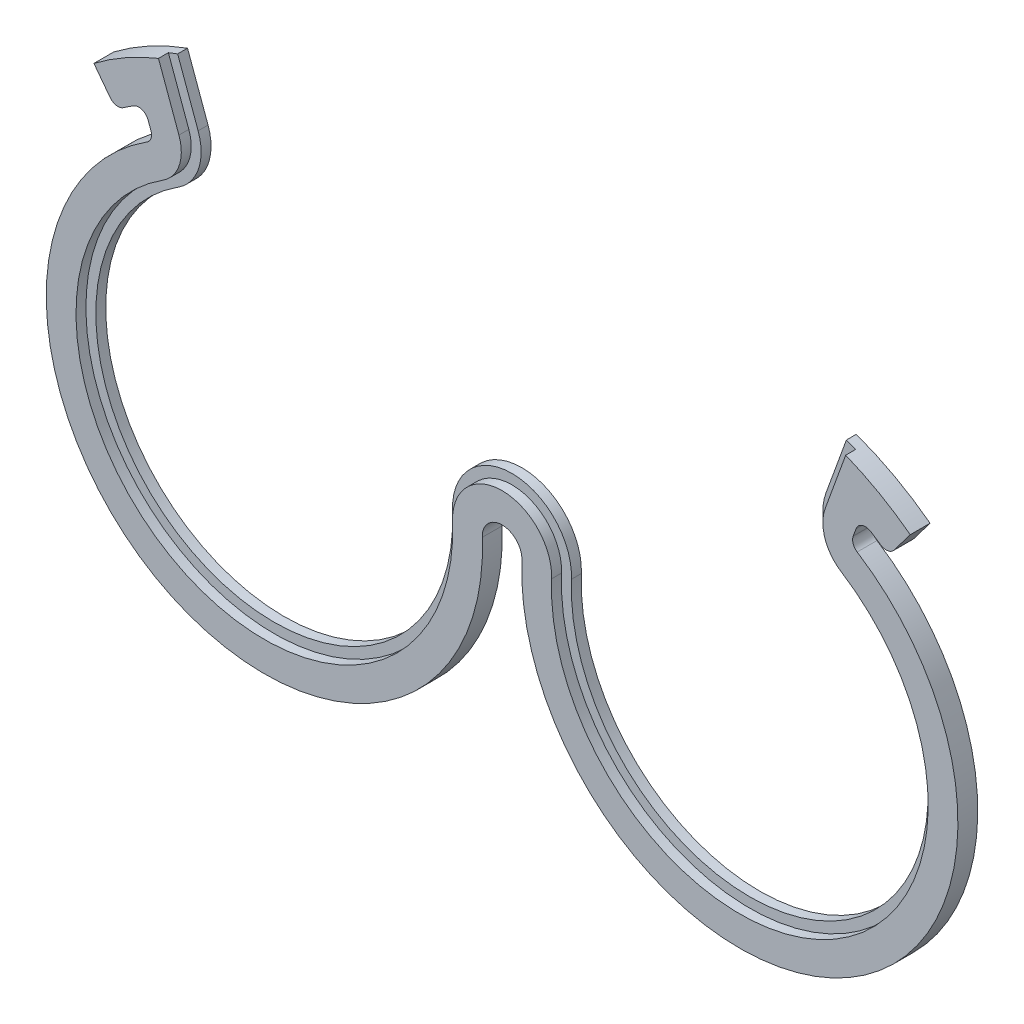
from build123d import *
from build123d.topology import SkipClean

# Parameters (mm, degrees)
BASE_EXTRUSION_DEPTH    = 2
ENL_V_START             = -1
ENL_V_MAT_EXTRU_1_DEPTH = 1


with BuildPart() as part:
    # Esquisse1 → Base-Extrusion (new body)
    with BuildSketch(Plane.XY):
        with BuildLine():
            Line((33.747574085, 26.781239692), (31.678333174, 21.096047015))
            ThreePointArc((31.678333174, 21.096047015), (31.641362763, 17.781057074), (33.686188392, 15.171610147))
            ThreePointArc((33.686188392, 15.171610147), (32.319294254, -15.962122137), (6.015631788, 0.75))
            ThreePointArc((6.015631788, 0.75), (4.350969402, 5.153311931), (0.020842383, 7))
            Line((0.020842383, 7), (0.020842383, 3))
            ThreePointArc((0.020842383, 3), (1.464218056, 2.38443731), (2.019105518, 0.916666667))
            ThreePointArc((2.019105518, 0.916666667), (34.168026311, -19.509260389), (35.838674701, 18.543079068))
            ThreePointArc((35.838674701, 18.543079068), (35.429709575, 19.064968454), (35.437103657, 19.727966442))
            Line((35.437103657, 19.727966442), (35.72395853, 20.516093727))
            ThreePointArc((35.72395853, 20.516093727), (36.339050842, 21.119924861), (37.195305146, 21.021035229))
            ThreePointArc((37.195305146, 21.021035229), (37.69827952, 20.696790529), (38.19329026, 20.360513539))
            ThreePointArc((38.19329026, 20.360513539), (38.921758709, 20.193200611), (39.562738511, 20.577654497))
            Line((39.562738511, 20.577654497), (41.19141405, 22.731152258))
            ThreePointArc((41.19141405, 22.731152258), (37.620869006, 25.034414863), (33.747574085, 26.781239692))
        make_face()
    extrude(amount=BASE_EXTRUSION_DEPTH)

    # Esquisse2 → Enlèv. mat.-Extru.1 (cut)
    with BuildSketch(Plane.XY.offset(2).offset(ENL_V_START)):
        with BuildLine():
            Line((33.747574085, 26.781239692), (31.678333174, 21.096047015))
            ThreePointArc((31.678333174, 21.096047015), (31.641362763, 17.781057074), (33.686188392, 15.171610147))
            ThreePointArc((33.686188392, 15.171610147), (32.319294254, -15.962122137), (6.015631788, 0.75))
            ThreePointArc((6.015631788, 0.75), (4.350969402, 5.153311931), (0.020842383, 7))
            Line((0.020842383, 7), (0.020842383, 6))
            ThreePointArc((0.020842383, 6), (3.629281566, 4.461093276), (5.01650022, 0.791666667))
            ThreePointArc((5.01650022, 0.791666667), (32.781477268, -16.8489067), (34.224309969, 16.014477377))
            ThreePointArc((34.224309969, 16.014477377), (32.588449466, 18.102034919), (32.618025795, 20.754026872))
            Line((32.618025795, 20.754026872), (34.681264504, 26.422728636))
            ThreePointArc((34.681264504, 26.422728636), (34.215992075, 26.606080244), (33.747574085, 26.781239692))
        make_face()
    extrude(amount=ENL_V_MAT_EXTRU_1_DEPTH, mode=Mode.SUBTRACT)

    # Bossage-Symétrie1: part across face


with BuildPart() as part_1:
    with SkipClean():  # the faces are left unmerged after this step: merging them gives an invalid solid
        add(part.part)
        add(part.part.mirror(Plane(origin=(0.020842383, 4.785714286, 0.928571429), x_dir=(0, 0, 1), z_dir=(-1, 0, 0))))


solid = part_1.part
